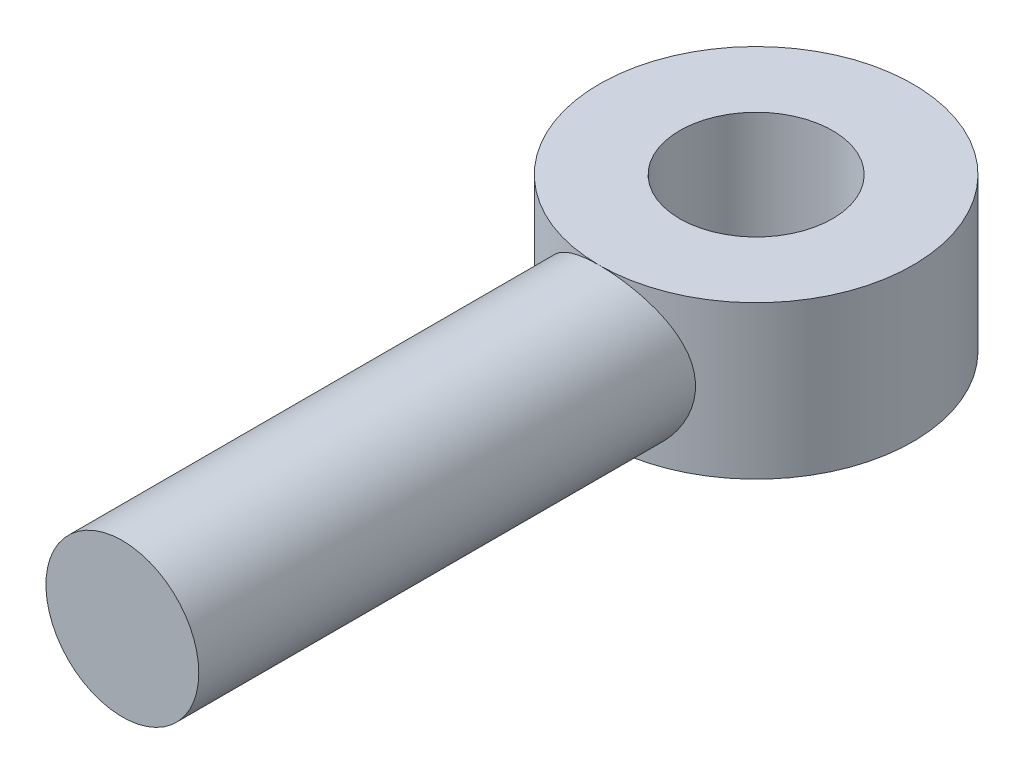
from build123d import *

# Parameters (mm, degrees)
SKETCH1_R           = 20
BOSS_EXTRUDE1_DEPTH = 130
SKETCH2_R           = 41.058497276
BOSS_EXTRUDE2_DEPTH = 20
SKETCH8_R           = 20
CUT_EXTRUDE1_DEPTH  = 40


with BuildPart() as part:
    # Sketch1 → Boss-Extrude1 (new body)
    with BuildSketch(Plane.XY):
        Circle(SKETCH1_R)
    extrude(amount=BOSS_EXTRUDE1_DEPTH)

    # Sketch2 → Boss-Extrude2 (add, symmetric)
    with BuildSketch(Plane(origin=(0, 0, 0), x_dir=(1, 0, 0), z_dir=(0, 1, 0))):
        with Locations((0, 35.858056257)):
            Circle(SKETCH2_R)
    extrude(amount=BOSS_EXTRUDE2_DEPTH, both=True)

    # Sketch8 → Cut-Extrude1 (cut)
    with BuildSketch(Plane(origin=(0, 20, 0), x_dir=(1, 0, 0), z_dir=(0, 1, 0))):
        with Locations(Location((0, 35.858056257, 0), (0, 0, 270))):
            Circle(SKETCH8_R)
    extrude(amount=-CUT_EXTRUDE1_DEPTH, mode=Mode.SUBTRACT)


solid = part.part
